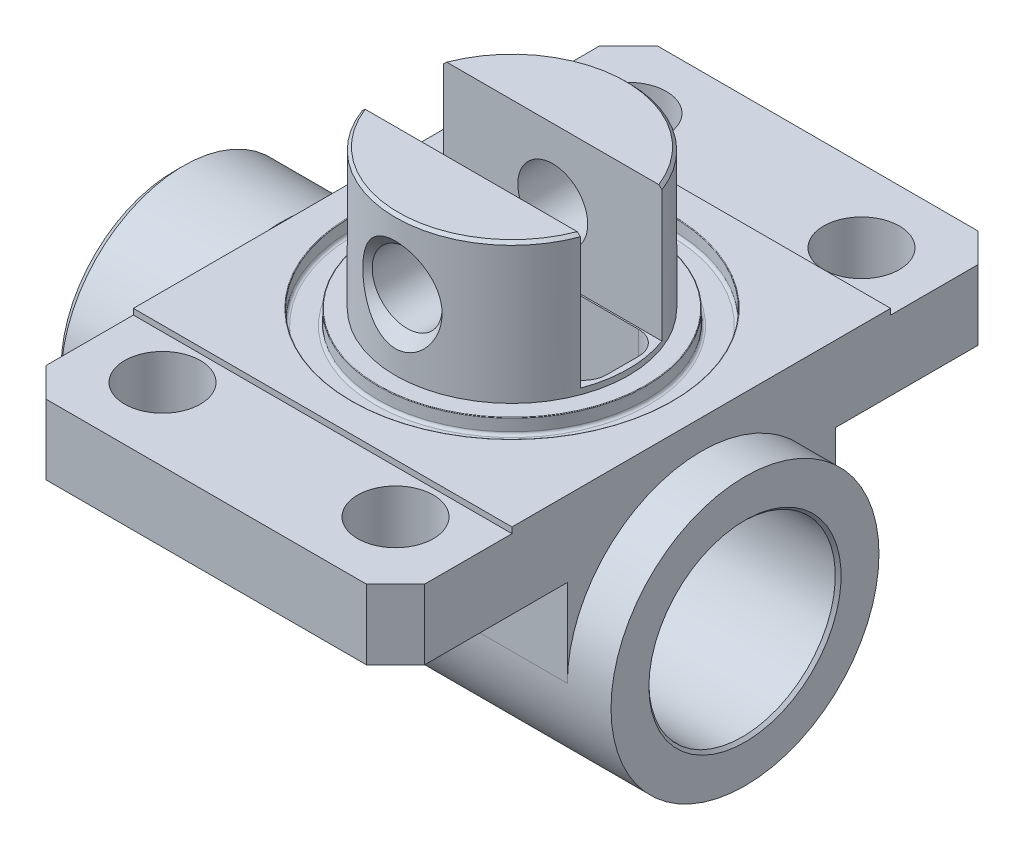
from build123d import *

# Parameters (mm, degrees)
EXTRUDE_START            = -24
SKETCH_3_W               = 65
SKETCH_3_H               = 65
SKETCH_3_R               = 19.5
EXTRUDE_1_DEPTH          = 1
EXTRUDE_3_DEPTH          = 12
FILLET_1_R               = 0.1
SKETCH_6_W               = 40
SKETCH_6_H               = 14
CUT_EXTRUDE_1_DEPTH      = 23
CUT_EXTRUDE_2_REACH      = 110.376
CUT_EXTRUDE_2_END_RADIUS = 16
CUT_EXTRUDE_3_DEPTH      = 101.445258844
CUT_EXTRUDE_3_DEPTH_BACK = 101.445258844
SKETCH_9_R               = 6
SKETCH_10_R              = 6.5
CUT_EXTRUDE_4_DEPTH      = 94.387633131
EXTRUDE_START_2          = -65
EXTRUDE_4_DEPTH          = 65
SKETCH_12_R              = 6
CUT_EXTRUDE_5_DEPTH      = 2
CUT_EXTRUDE_5_DRAFT      = -45
MIRROR_1_COPY_1_SKETCH_R = 6
MIRROR_1_COPY_1_DEPTH    = 2
MIRROR_1_COPY_1_DRAFT    = -45


with BuildPart() as part:
    # Эскиз1 → Повернуть1 (revolve)
    with BuildSketch(Plane.XY, mode=Mode.PRIVATE) as revolve_1_sk:
        with BuildLine():
            Line((-36.8, -20.15), (-38.16862915, -20.15))
            ThreePointArc((-38.16862915, -20.15), (-38.474775896, -20.089103626), (-38.734314575, -19.915685425))
            Line((-38.734314575, -19.915685425), (-39.65, -19))
            Line((-39.65, -19), (-56.4, -19))
            Line((-56.4, -19), (-58, -20.6))
            Line((-58, -20.6), (-58, -24))
            Line((-58, -24), (39.5, -24))
            Line((39.5, -24), (40, -23.5))
            Line((40, -23.5), (40, -17))
            Line((40, -17), (-36, -17))
            Line((-36, -17), (-36, -19.35))
            ThreePointArc((-36, -19.35), (-36.234314575, -19.915685425), (-36.8, -20.15))
        make_face()
        Polygon((-58, -40), (40, -40), (40, -23.5), (39.5, -24), (-58, -24), align=None)
    revolve(revolve_1_sk.sketch.rotate(Axis((-81.569048794, -40, 0), (1, 0, 0)), 90), axis=Axis((-81.569048794, -40, 0), (1, 0, 0)))

    # Эскиз2 → Повернуть2 (revolve)
    with BuildSketch(Plane.XY, mode=Mode.PRIVATE) as revolve_2_sk:
        Polygon((0, 12), (-19.5, 12), (-20, 11.5), (-20, -40), (0, -40), align=None)
    revolve(revolve_2_sk.sketch.rotate(Axis((0, 30.113226236, 0), (0, -1, 0)), 270), axis=Axis((0, 30.113226236, 0), (0, -1, 0)))

    # Эскиз3 → Бобышка-Вытянуть1 (add)
    with BuildSketch(Plane(origin=(0, 12, 0), x_dir=(1, 0, 0), z_dir=(0, 1, 0)).offset(EXTRUDE_START)):
        Rectangle(SKETCH_3_W, SKETCH_3_H)
        Circle(SKETCH_3_R, mode=Mode.SUBTRACT)
    extrude(amount=-EXTRUDE_1_DEPTH)

    # Эскиз4 → Бобышка-Вытянуть3 (add)
    with BuildSketch(Plane.XZ.offset(13)):
        Polygon((-32.5, -47.5), (-27.5, -52.5), (27.5, -52.5), (32.5, -47.5), (32.5, 47.5), (27.5, 52.5), (-27.5, 52.5), (-32.5, 47.5), align=None)
    extrude(amount=EXTRUDE_3_DEPTH)

    # Эскиз5 → Вырез-Повернуть1 (revolve, cut)
    with BuildSketch(Plane.XY, mode=Mode.PRIVATE) as cut_revolve_1_sk:
        with BuildLine():
            Line((-23, -12), (-27.5, -12))
            Line((-27.5, -12), (-27.5, -14.1))
            ThreePointArc((-27.5, -14.1), (-27.353553391, -14.453553391), (-27, -14.6))
            Line((-27, -14.6), (-23.5, -14.6))
            ThreePointArc((-23.5, -14.6), (-23.146446609, -14.453553391), (-23, -14.1))
            Line((-23, -14.1), (-23, -12))
        make_face()
    revolve(cut_revolve_1_sk.sketch.rotate(Axis((0, 0, 0), (0, -1, 0)), 270), axis=Axis((0, 0, 0), (0, -1, 0)), mode=Mode.SUBTRACT)

    # Скругление1
    fillet_1_edges = [part.edges().sort_by_distance(p)[0] for p in [
        (0, -12, -23),
        (0, -12, -27.5),
    ]]
    fillet(fillet_1_edges, radius=FILLET_1_R)

    # Эскиз6 → Вырез-Вытянуть1 (cut)
    with BuildSketch(Plane(origin=(0, 12, 0), x_dir=(1, 0, 0), z_dir=(0, 1, 0))):
        Rectangle(SKETCH_6_W, SKETCH_6_H)
    extrude(amount=-CUT_EXTRUDE_1_DEPTH, mode=Mode.SUBTRACT)

    # Эскиз1<3> → Вырез-Повернуть2 (revolve, cut)
    with BuildSketch(Plane.XY, mode=Mode.PRIVATE) as cut_revolve_2_sk:
        Polygon((-58, -40), (40, -40), (40, -23.5), (39.5, -24), (-58, -24), align=None)
    revolve(cut_revolve_2_sk.sketch.rotate(Axis((-81.569048794, -40, 0), (1, 0, 0)), 90), axis=Axis((-81.569048794, -40, 0), (1, 0, 0)), mode=Mode.SUBTRACT)

    # Вырез-Вытянуть2: up to this cylinder (the profile starts outside it)
    cut_extrude_2_end = Plane(origin=(0, -40, 0), z_dir=(-1, 0, 0)) * Cylinder(CUT_EXTRUDE_2_END_RADIUS, 253.752, mode=Mode.PRIVATE)
    # Эскиз8 → Вырез-Вытянуть2 (cut, up to the surface)
    with BuildSketch(Plane(origin=(0, 12, 0), x_dir=(1, 0, 0), z_dir=(0, 1, 0)), mode=Mode.PRIVATE) as cut_extrude_2_sk1:
        with BuildLine():
            Line((-15, 6.75), (15, 6.75))
            ThreePointArc((15, 6.75), (17.828427125, 5.578427125), (19, 2.75))
            Line((19, 2.75), (19, -2.75))
            ThreePointArc((19, -2.75), (17.828427125, -5.578427125), (15, -6.75))
            Line((15, -6.75), (-15, -6.75))
            ThreePointArc((-15, -6.75), (-17.828427125, -5.578427125), (-19, -2.75))
            Line((-19, -2.75), (-19, 2.75))
            ThreePointArc((-19, 2.75), (-17.828427125, 5.578427125), (-15, 6.75))
        make_face()
    cut_extrude_2_tool1 = extrude(cut_extrude_2_sk1.sketch, amount=-CUT_EXTRUDE_2_REACH, mode=Mode.PRIVATE) - cut_extrude_2_end
    add(cut_extrude_2_tool1.solids().sort_by_distance((0, 12, 0))[0], mode=Mode.SUBTRACT)

    # Эскиз9 → Вырез-Вытянуть3 (cut, two sides: drawn at the far end of the back side and taken through both)
    with BuildSketch(Plane.XY.offset(-CUT_EXTRUDE_3_DEPTH_BACK)):
        Circle(SKETCH_9_R)
    extrude(amount=CUT_EXTRUDE_3_DEPTH + CUT_EXTRUDE_3_DEPTH_BACK, mode=Mode.SUBTRACT)

    # Эскиз10 → Вырез-Вытянуть4 (cut, through all)
    with BuildSketch(Plane(origin=(0, -12, 0), x_dir=(1, 0, 0), z_dir=(0, 1, 0))):
        with Locations(Location((-20, 40, 0), (0, 0, 90))):
            Circle(SKETCH_10_R)
        with Locations(Location((20, 40, 0), (0, 0, 90))):
            Circle(SKETCH_10_R)
        with Locations(Location((20, -40, 0), (0, 0, 90))):
            Circle(SKETCH_10_R)
        with Locations(Location((-20, -40, 0), (0, 0, 90))):
            Circle(SKETCH_10_R)
    extrude(amount=-CUT_EXTRUDE_4_DEPTH, mode=Mode.SUBTRACT)

    # Эскиз11 → Бобышка-Вытянуть4 (add)
    with BuildSketch(Plane(origin=(32.5, 0, 0), x_dir=(0, 0, -1), z_dir=(1, 0, 0)).offset(EXTRUDE_START_2)):
        with BuildLine():
            Line((-17.435595774, -25), (-23, -25))
            Line((-23, -25), (-23, -40))
            ThreePointArc((-23, -40), (-21.564075482, -32.000584484), (-17.435595774, -25))
        make_face()
        with BuildLine():
            Line((23, -25), (17.435595774, -25))
            ThreePointArc((17.435595774, -25), (21.564075482, -32.000584484), (23, -40))
            Line((23, -40), (23, -25))
        make_face()
    extrude(amount=EXTRUDE_4_DEPTH)


with BuildPart() as cut_extrude_5_tool:
    # Эскиз12 → Вырез-Вытянуть5 (with draft: the straight prism first)
    with BuildSketch(Plane.XY.offset(18)):
        Circle(SKETCH_12_R)
    extrude(amount=CUT_EXTRUDE_5_DEPTH)
    # Вырез-Вытянуть5: the draft: its side faces are tilted about the plane it starts from
    cut_extrude_5_sides = [cut_extrude_5_tool.faces().sort_by_distance(p)[0] for p in [
        (-6, 0, 19),
    ]]
    draft(cut_extrude_5_sides, Plane.XY.offset(18), CUT_EXTRUDE_5_DRAFT)


with BuildPart() as part_1:
    add(part.part)

    # Вырез-Вытянуть5: cut by cut_extrude_5_tool
    add(cut_extrude_5_tool.part, mode=Mode.SUBTRACT)


with BuildPart() as mirror_1_copy_1_tool:
    # Зеркальное отражение1 copy 1 sketch → Зеркальное отражение1 copy 1 (with draft: the straight prism first)
    with BuildSketch(Plane(origin=(0, 0, -18), x_dir=(1, 0, 0), z_dir=(0, 0, -1))):
        Circle(MIRROR_1_COPY_1_SKETCH_R)
    extrude(amount=MIRROR_1_COPY_1_DEPTH)
    # Зеркальное отражение1 copy 1: the draft: its side faces are tilted about the plane it starts from
    mirror_1_copy_1_sides = [mirror_1_copy_1_tool.faces().sort_by_distance(p)[0] for p in [
        (-6, 0, -19),
    ]]
    draft(mirror_1_copy_1_sides, Plane(origin=(0, 0, -18), x_dir=(1, 0, 0), z_dir=(0, 0, -1)), MIRROR_1_COPY_1_DRAFT)


with BuildPart() as part_2:
    add(part_1.part)

    # Зеркальное отражение1 copy 1: cut by mirror_1_copy_1_tool
    add(mirror_1_copy_1_tool.part, mode=Mode.SUBTRACT)


solid = part_2.part
